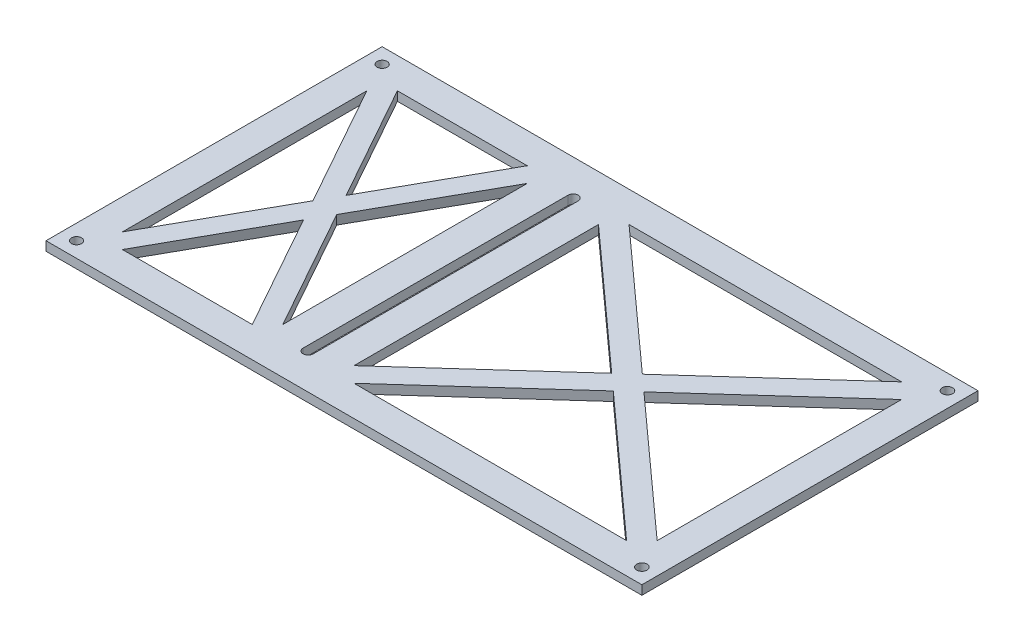
from build123d import *

# Parameters (mm, degrees)
SKETCH_1_W      = 195
SKETCH_1_H      = 110
SKETCH_1_R      = 1.65
SKETCH_1_R_2    = 1.7
EXTRUDE_1_DEPTH = 3


with BuildPart() as part:
    # 草图1 → 凸台-拉伸1 (new body)
    with BuildSketch(Plane(origin=(0, 0, 0), x_dir=(1, 0, 0), z_dir=(0, 1, 0))):
        with Locations((92.5, 50)):
            Rectangle(SKETCH_1_W, SKETCH_1_H)
        with Locations(Location((0, 0, 0), (0, 0, 270))):
            Circle(SKETCH_1_R, mode=Mode.SUBTRACT)
        with Locations(Location((0, 100, 0), (0, 0, 270))):
            Circle(SKETCH_1_R, mode=Mode.SUBTRACT)
        with Locations(Location((185, 100, 0), (0, 0, 270))):
            Circle(SKETCH_1_R_2, mode=Mode.SUBTRACT)
        with Locations(Location((185, 0, 0), (0, 0, 270))):
            Circle(SKETCH_1_R_2, mode=Mode.SUBTRACT)
        with BuildLine():
            Line((67.5, 6.65), (67.5, 93.35))
            ThreePointArc((67.5, 93.35), (69.15, 95), (70.8, 93.35))
            Line((70.8, 93.35), (70.8, 6.65))
            ThreePointArc((70.8, 6.65), (69.15, 5), (67.5, 6.65))
        make_face(mode=Mode.SUBTRACT)
        Polygon((5, 90), (27.352941176, 50), (5, 10), align=None, mode=Mode.SUBTRACT)
        Polygon((10, 95), (52.5, 95), (31.25, 56.973684211), align=None, mode=Mode.SUBTRACT)
        Polygon((10, 5), (52.5, 5), (31.25, 43.026315789), align=None, mode=Mode.SUBTRACT)
        Polygon((57.5, 90), (57.5, 10), (35.147058824, 50), align=None, mode=Mode.SUBTRACT)
        Polygon((85.8, 5), (175, 5), (130.4, 45.244161359), align=None, mode=Mode.SUBTRACT)
        Polygon((80.8, 10), (80.8, 90), (125.129411765, 50), align=None, mode=Mode.SUBTRACT)
        Polygon((85.8, 95), (175, 95), (130.4, 54.755838641), align=None, mode=Mode.SUBTRACT)
        Polygon((180, 10), (180, 90), (135.670588235, 50), align=None, mode=Mode.SUBTRACT)
    extrude(amount=EXTRUDE_1_DEPTH)


solid = part.part
